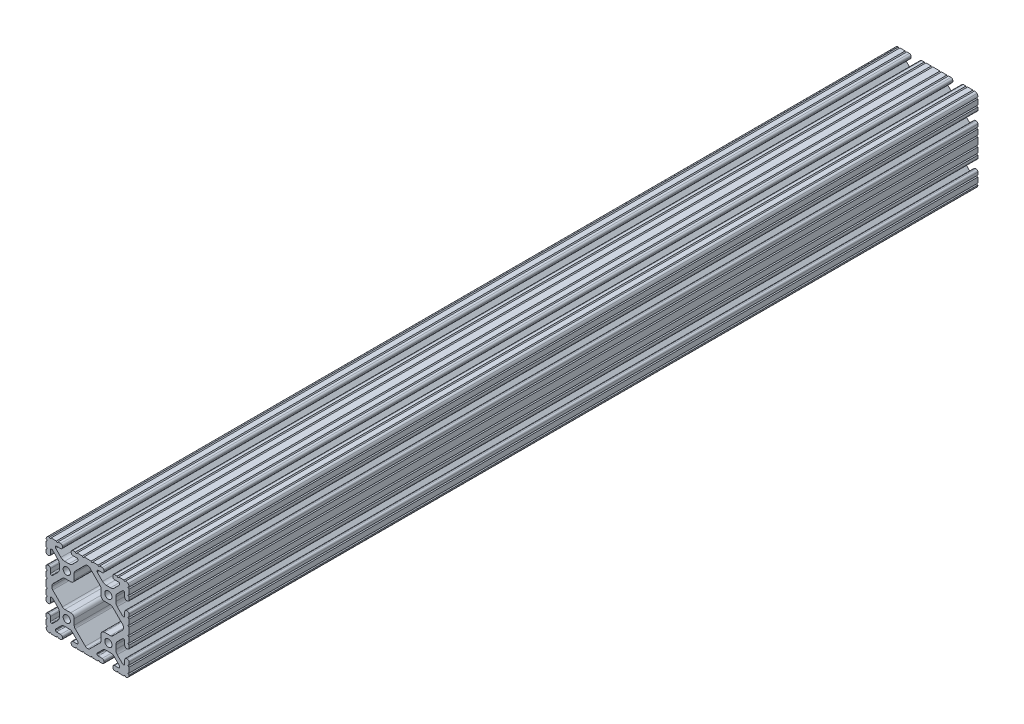
from build123d import *

# Parameters (mm, degrees)
BOSS_EXTRUDE1_DEPTH      = 388.8
BOSS_EXTRUDE1_DEPTH_BACK = 388.8
SKETCH3_R                = 3.3274


with BuildPart() as part:
    # Sketch3 → Boss-Extrude1 (new, two sides: drawn at the far end of the back side and taken through both)
    with BuildSketch(Plane.XY.offset(-BOSS_EXTRUDE1_DEPTH_BACK)):
        with BuildLine():
            Line((34.036, 28.448), (34.036, 24.630196049))
            ThreePointArc((34.036, 24.630196049), (34.497248241, 23.51664429), (35.6108, 23.055396049))
            Line((35.6108, 23.055396049), (36.525200183, 23.055396049))
            ThreePointArc((36.525200183, 23.055396049), (37.638751813, 23.516644236), (38.1, 24.630195866))
            Line((38.1, 24.630195866), (38.1, 27.023826138))
            ThreePointArc((38.1, 27.023826138), (37.117780706, 27.7845421), (38.1, 28.545258062))
            Line((38.1, 28.545258062), (38.1, 33.373016026))
            ThreePointArc((38.1, 33.373016026), (37.141472621, 34.109236774), (38.1, 34.845457521))
            ThreePointArc((38.1, 34.845457521), (37.837757813, 36.120195002), (37.086123144, 37.182631793))
            ThreePointArc((37.086123144, 37.182631793), (36.106286572, 37.843374398), (34.952681874, 38.1))
            ThreePointArc((34.952681874, 38.1), (34.190730434, 37.320215335), (33.428778994, 38.1))
            Line((33.428778994, 38.1), (28.601105935, 38.1))
            ThreePointArc((28.601105935, 38.1), (27.839158581, 37.32021942), (27.077211227, 38.1))
            Line((27.077211227, 38.1), (24.6888, 38.1))
            ThreePointArc((24.6888, 38.1), (23.575248241, 37.638751759), (23.114, 36.5252))
            Line((23.114, 36.5252), (23.114, 35.6108))
            ThreePointArc((23.114, 35.6108), (23.575248241, 34.497248241), (24.6888, 34.036))
            Line((24.6888, 34.036), (28.448, 34.036))
            ThreePointArc((28.448, 34.036), (29.076617928, 33.775617928), (29.337, 33.147))
            Line((29.337, 33.147), (29.337, 32.720693454))
            ThreePointArc((29.337, 32.720693454), (29.326675076, 32.273872751), (29.100231244, 31.888543625))
            Line((29.100231244, 31.888543625), (24.409287499, 27.197588341))
            ThreePointArc((24.409287499, 27.197588341), (22.868340045, 26.167958114), (21.050667579, 25.8064))
            Line((21.050667579, 25.8064), (17.049332421, 25.8064))
            ThreePointArc((17.049332421, 25.8064), (15.231659955, 26.167958114), (13.690712501, 27.197588341))
            Line((13.690712501, 27.197588341), (9.023381298, 31.864931024))
            ThreePointArc((9.023381298, 31.864931024), (8.830670886, 32.153343113), (8.763, 32.493548179))
            Line((8.763, 32.493548179), (8.763, 33.147))
            ThreePointArc((8.763, 33.147), (9.023382072, 33.775617928), (9.652, 34.036))
            Line((9.652, 34.036), (13.4112, 34.036))
            ThreePointArc((13.4112, 34.036), (14.524751759, 34.497248241), (14.986, 35.6108))
            Line((14.986, 35.6108), (14.986, 36.5252))
            ThreePointArc((14.986, 36.5252), (14.524751759, 37.638751759), (13.4112, 38.1))
            Line((13.4112, 38.1), (11.128867074, 38.1))
            ThreePointArc((11.128867074, 38.1), (10.367071033, 37.320370693), (9.605274992, 38.1))
            Line((9.605274992, 38.1), (4.777313069, 38.1))
            ThreePointArc((4.777313069, 38.1), (4.015517029, 37.320370693), (3.253720988, 38.1))
            Line((3.253720988, 38.1), (-3.253720988, 38.1))
            ThreePointArc((-3.253720988, 38.1), (-4.015517029, 37.320370693), (-4.777313069, 38.1))
            Line((-4.777313069, 38.1), (-9.605274992, 38.1))
            ThreePointArc((-9.605274992, 38.1), (-10.367071033, 37.320370693), (-11.128867074, 38.1))
            Line((-11.128867074, 38.1), (-13.4112, 38.1))
            ThreePointArc((-13.4112, 38.1), (-14.524751759, 37.638751759), (-14.986, 36.5252))
            Line((-14.986, 36.5252), (-14.986, 35.6108))
            ThreePointArc((-14.986, 35.6108), (-14.524751759, 34.497248241), (-13.4112, 34.036))
            Line((-13.4112, 34.036), (-9.652, 34.036))
            ThreePointArc((-9.652, 34.036), (-9.023382072, 33.775617928), (-8.763, 33.147))
            Line((-8.763, 33.147), (-8.763, 32.493548179))
            ThreePointArc((-8.763, 32.493548179), (-8.830670886, 32.153343113), (-9.023381298, 31.864931024))
            Line((-9.023381298, 31.864931024), (-13.690712501, 27.197588341))
            ThreePointArc((-13.690712501, 27.197588341), (-15.231659955, 26.167958114), (-17.049332421, 25.8064))
            Line((-17.049332421, 25.8064), (-21.050667579, 25.8064))
            ThreePointArc((-21.050667579, 25.8064), (-22.868340045, 26.167958114), (-24.409287499, 27.197588341))
            Line((-24.409287499, 27.197588341), (-29.100231244, 31.888543625))
            ThreePointArc((-29.100231244, 31.888543625), (-29.326675076, 32.273872751), (-29.337, 32.720693454))
            Line((-29.337, 32.720693454), (-29.337, 33.147))
            ThreePointArc((-29.337, 33.147), (-29.076617928, 33.775617928), (-28.448, 34.036))
            Line((-28.448, 34.036), (-24.6888, 34.036))
            ThreePointArc((-24.6888, 34.036), (-23.575248241, 34.497248241), (-23.114, 35.6108))
            Line((-23.114, 35.6108), (-23.114, 36.5252))
            ThreePointArc((-23.114, 36.5252), (-23.575248241, 37.638751759), (-24.6888, 38.1))
            Line((-24.6888, 38.1), (-27.077211227, 38.1))
            ThreePointArc((-27.077211227, 38.1), (-27.839158581, 37.32021942), (-28.601105935, 38.1))
            Line((-28.601105935, 38.1), (-33.428778994, 38.1))
            ThreePointArc((-33.428778994, 38.1), (-34.190730434, 37.320215335), (-34.952681874, 38.1))
            ThreePointArc((-34.952681874, 38.1), (-36.106286572, 37.843374398), (-37.086123144, 37.182631793))
            ThreePointArc((-37.086123144, 37.182631793), (-37.837757813, 36.120195002), (-38.1, 34.845457521))
            ThreePointArc((-38.1, 34.845457521), (-37.141472621, 34.109236774), (-38.1, 33.373016026))
            Line((-38.1, 33.373016026), (-38.1, 28.545258062))
            ThreePointArc((-38.1, 28.545258062), (-37.117780706, 27.7845421), (-38.1, 27.023826138))
            Line((-38.1, 27.023826138), (-38.1, 24.630195866))
            ThreePointArc((-38.1, 24.630195866), (-37.638751813, 23.516644236), (-36.525200183, 23.055396049))
            Line((-36.525200183, 23.055396049), (-35.6108, 23.055396049))
            ThreePointArc((-35.6108, 23.055396049), (-34.497248241, 23.51664429), (-34.036, 24.630196049))
            Line((-34.036, 24.630196049), (-34.036, 28.448))
            ThreePointArc((-34.036, 28.448), (-33.775617928, 29.076617928), (-33.147, 29.337))
            Line((-33.147, 29.337), (-32.664287242, 29.337))
            ThreePointArc((-32.664287242, 29.337), (-32.324081166, 29.269328695), (-32.03566854, 29.076617155))
            Line((-32.03566854, 29.076617155), (-27.19758008, 24.238516795))
            ThreePointArc((-27.19758008, 24.238516795), (-26.167955879, 22.697572205), (-25.8064, 20.879905136))
            Line((-25.8064, 20.879905136), (-25.8064, 17.220094864))
            ThreePointArc((-25.8064, 17.220094864), (-26.167955879, 15.402427795), (-27.19758008, 13.861483205))
            Line((-27.19758008, 13.861483205), (-31.948944541, 9.110107057))
            ThreePointArc((-31.948944541, 9.110107057), (-32.333417096, 8.853210196), (-32.786933649, 8.763))
            Line((-32.786933649, 8.763), (-33.060275787, 8.763))
            ThreePointArc((-33.060275787, 8.763), (-33.750216995, 9.048783005), (-34.036, 9.738724213))
            Line((-34.036, 9.738724213), (-34.036, 13.469803585))
            ThreePointArc((-34.036, 13.469803585), (-34.497248348, 14.583355603), (-35.610800366, 15.044603951))
            Line((-35.610800366, 15.044603951), (-36.5252, 15.044603951))
            ThreePointArc((-36.5252, 15.044603951), (-37.638751759, 14.58335571), (-38.1, 13.469803951))
            Line((-38.1, 13.469803951), (-38.1, 11.075039289))
            ThreePointArc((-38.1, 11.075039289), (-37.117000248, 10.313517272), (-38.1, 9.551995255))
            Line((-38.1, 9.551995255), (-38.1, 4.723759308))
            ThreePointArc((-38.1, 4.723759308), (-37.117000248, 3.962237292), (-38.1, 3.200715275))
            Line((-38.1, 3.200715275), (-38.1, -3.200715275))
            ThreePointArc((-38.1, -3.200715275), (-37.117000248, -3.962237292), (-38.1, -4.723759308))
            Line((-38.1, -4.723759308), (-38.1, -9.551995255))
            ThreePointArc((-38.1, -9.551995255), (-37.117000248, -10.313517272), (-38.1, -11.075039289))
            Line((-38.1, -11.075039289), (-38.1, -13.469803951))
            ThreePointArc((-38.1, -13.469803951), (-37.638751759, -14.58335571), (-36.5252, -15.044603951))
            Line((-36.5252, -15.044603951), (-35.610800366, -15.044603951))
            ThreePointArc((-35.610800366, -15.044603951), (-34.497248348, -14.583355603), (-34.036, -13.469803585))
            Line((-34.036, -13.469803585), (-34.036, -9.738724213))
            ThreePointArc((-34.036, -9.738724213), (-33.750216995, -9.048783005), (-33.060275787, -8.763))
            Line((-33.060275787, -8.763), (-32.786933649, -8.763))
            ThreePointArc((-32.786933649, -8.763), (-32.333417096, -8.853210196), (-31.948944541, -9.110107057))
            Line((-31.948944541, -9.110107057), (-27.19758008, -13.861483205))
            ThreePointArc((-27.19758008, -13.861483205), (-26.167955879, -15.402427795), (-25.8064, -17.220094864))
            Line((-25.8064, -17.220094864), (-25.8064, -20.879905136))
            ThreePointArc((-25.8064, -20.879905136), (-26.167955879, -22.697572205), (-27.19758008, -24.238516795))
            Line((-27.19758008, -24.238516795), (-32.03566854, -29.076617155))
            ThreePointArc((-32.03566854, -29.076617155), (-32.324081166, -29.269328695), (-32.664287242, -29.337))
            Line((-32.664287242, -29.337), (-33.147, -29.337))
            ThreePointArc((-33.147, -29.337), (-33.775617928, -29.076617928), (-34.036, -28.448))
            Line((-34.036, -28.448), (-34.036, -24.630196049))
            ThreePointArc((-34.036, -24.630196049), (-34.497248241, -23.51664429), (-35.6108, -23.055396049))
            Line((-35.6108, -23.055396049), (-36.525200183, -23.055396049))
            ThreePointArc((-36.525200183, -23.055396049), (-37.638751813, -23.516644236), (-38.1, -24.630195866))
            Line((-38.1, -24.630195866), (-38.1, -27.023826138))
            ThreePointArc((-38.1, -27.023826138), (-37.117780706, -27.7845421), (-38.1, -28.545258062))
            Line((-38.1, -28.545258062), (-38.1, -33.373016026))
            ThreePointArc((-38.1, -33.373016026), (-37.141472621, -34.109236774), (-38.1, -34.845457521))
            ThreePointArc((-38.1, -34.845457521), (-37.837757813, -36.120195002), (-37.086123144, -37.182631793))
            ThreePointArc((-37.086123144, -37.182631793), (-36.106286572, -37.843374398), (-34.952681874, -38.1))
            ThreePointArc((-34.952681874, -38.1), (-34.190730434, -37.320215335), (-33.428778994, -38.1))
            Line((-33.428778994, -38.1), (-28.601105935, -38.1))
            ThreePointArc((-28.601105935, -38.1), (-27.839158581, -37.32021942), (-27.077211227, -38.1))
            Line((-27.077211227, -38.1), (-24.6888, -38.1))
            ThreePointArc((-24.6888, -38.1), (-23.575248241, -37.638751759), (-23.114, -36.5252))
            Line((-23.114, -36.5252), (-23.114, -35.6108))
            ThreePointArc((-23.114, -35.6108), (-23.575248241, -34.497248241), (-24.6888, -34.036))
            Line((-24.6888, -34.036), (-28.448, -34.036))
            ThreePointArc((-28.448, -34.036), (-29.076617928, -33.775617928), (-29.337, -33.147))
            Line((-29.337, -33.147), (-29.337, -32.720693454))
            ThreePointArc((-29.337, -32.720693454), (-29.326675076, -32.273872751), (-29.100231244, -31.888543625))
            Line((-29.100231244, -31.888543625), (-24.409287499, -27.197588341))
            ThreePointArc((-24.409287499, -27.197588341), (-22.868340045, -26.167958114), (-21.050667579, -25.8064))
            Line((-21.050667579, -25.8064), (-17.049332421, -25.8064))
            ThreePointArc((-17.049332421, -25.8064), (-15.231659955, -26.167958114), (-13.690712501, -27.197588341))
            Line((-13.690712501, -27.197588341), (-9.023381298, -31.864931024))
            ThreePointArc((-9.023381298, -31.864931024), (-8.830670886, -32.153343113), (-8.763, -32.493548179))
            Line((-8.763, -32.493548179), (-8.763, -33.147))
            ThreePointArc((-8.763, -33.147), (-9.023382072, -33.775617928), (-9.652, -34.036))
            Line((-9.652, -34.036), (-13.4112, -34.036))
            ThreePointArc((-13.4112, -34.036), (-14.524751759, -34.497248241), (-14.986, -35.6108))
            Line((-14.986, -35.6108), (-14.986, -36.5252))
            ThreePointArc((-14.986, -36.5252), (-14.524751759, -37.638751759), (-13.4112, -38.1))
            Line((-13.4112, -38.1), (-11.128867074, -38.1))
            ThreePointArc((-11.128867074, -38.1), (-10.367071033, -37.320370693), (-9.605274992, -38.1))
            Line((-9.605274992, -38.1), (-4.777313069, -38.1))
            ThreePointArc((-4.777313069, -38.1), (-4.015517029, -37.320370693), (-3.253720988, -38.1))
            Line((-3.253720988, -38.1), (3.253720988, -38.1))
            ThreePointArc((3.253720988, -38.1), (4.015517029, -37.320370693), (4.777313069, -38.1))
            Line((4.777313069, -38.1), (9.605274992, -38.1))
            ThreePointArc((9.605274992, -38.1), (10.367071033, -37.320370693), (11.128867074, -38.1))
            Line((11.128867074, -38.1), (13.4112, -38.1))
            ThreePointArc((13.4112, -38.1), (14.524751759, -37.638751759), (14.986, -36.5252))
            Line((14.986, -36.5252), (14.986, -35.6108))
            ThreePointArc((14.986, -35.6108), (14.524751759, -34.497248241), (13.4112, -34.036))
            Line((13.4112, -34.036), (9.652, -34.036))
            ThreePointArc((9.652, -34.036), (9.023382072, -33.775617928), (8.763, -33.147))
            Line((8.763, -33.147), (8.763, -32.493548179))
            ThreePointArc((8.763, -32.493548179), (8.830670886, -32.153343113), (9.023381298, -31.864931024))
            Line((9.023381298, -31.864931024), (13.690712501, -27.197588341))
            ThreePointArc((13.690712501, -27.197588341), (15.231659955, -26.167958114), (17.049332421, -25.8064))
            Line((17.049332421, -25.8064), (21.050667579, -25.8064))
            ThreePointArc((21.050667579, -25.8064), (22.868340045, -26.167958114), (24.409287499, -27.197588341))
            Line((24.409287499, -27.197588341), (29.100231244, -31.888543625))
            ThreePointArc((29.100231244, -31.888543625), (29.326675076, -32.273872751), (29.337, -32.720693454))
            Line((29.337, -32.720693454), (29.337, -33.147))
            ThreePointArc((29.337, -33.147), (29.076617928, -33.775617928), (28.448, -34.036))
            Line((28.448, -34.036), (24.6888, -34.036))
            ThreePointArc((24.6888, -34.036), (23.575248241, -34.497248241), (23.114, -35.6108))
            Line((23.114, -35.6108), (23.114, -36.5252))
            ThreePointArc((23.114, -36.5252), (23.575248241, -37.638751759), (24.6888, -38.1))
            Line((24.6888, -38.1), (27.077211227, -38.1))
            ThreePointArc((27.077211227, -38.1), (27.839158581, -37.32021942), (28.601105935, -38.1))
            Line((28.601105935, -38.1), (33.428778994, -38.1))
            ThreePointArc((33.428778994, -38.1), (34.190730434, -37.320215335), (34.952681874, -38.1))
            ThreePointArc((34.952681874, -38.1), (36.106286572, -37.843374398), (37.086123144, -37.182631793))
            ThreePointArc((37.086123144, -37.182631793), (37.837757813, -36.120195002), (38.1, -34.845457521))
            ThreePointArc((38.1, -34.845457521), (37.141472621, -34.109236774), (38.1, -33.373016026))
            Line((38.1, -33.373016026), (38.1, -28.545258062))
            ThreePointArc((38.1, -28.545258062), (37.117780706, -27.7845421), (38.1, -27.023826138))
            Line((38.1, -27.023826138), (38.1, -24.630195866))
            ThreePointArc((38.1, -24.630195866), (37.638751813, -23.516644236), (36.525200183, -23.055396049))
            Line((36.525200183, -23.055396049), (35.6108, -23.055396049))
            ThreePointArc((35.6108, -23.055396049), (34.497248241, -23.51664429), (34.036, -24.630196049))
            Line((34.036, -24.630196049), (34.036, -28.448))
            ThreePointArc((34.036, -28.448), (33.775617928, -29.076617928), (33.147, -29.337))
            Line((33.147, -29.337), (32.664287242, -29.337))
            ThreePointArc((32.664287242, -29.337), (32.324081166, -29.269328695), (32.03566854, -29.076617155))
            Line((32.03566854, -29.076617155), (27.19758008, -24.238516795))
            ThreePointArc((27.19758008, -24.238516795), (26.167955879, -22.697572205), (25.8064, -20.879905136))
            Line((25.8064, -20.879905136), (25.8064, -17.220094864))
            ThreePointArc((25.8064, -17.220094864), (26.167955879, -15.402427795), (27.19758008, -13.861483205))
            Line((27.19758008, -13.861483205), (31.948944541, -9.110107057))
            ThreePointArc((31.948944541, -9.110107057), (32.333417096, -8.853210196), (32.786933649, -8.763))
            Line((32.786933649, -8.763), (33.060275787, -8.763))
            ThreePointArc((33.060275787, -8.763), (33.750216995, -9.048783005), (34.036, -9.738724213))
            Line((34.036, -9.738724213), (34.036, -13.469803585))
            ThreePointArc((34.036, -13.469803585), (34.497248348, -14.583355603), (35.610800366, -15.044603951))
            Line((35.610800366, -15.044603951), (36.5252, -15.044603951))
            ThreePointArc((36.5252, -15.044603951), (37.638751759, -14.58335571), (38.1, -13.469803951))
            Line((38.1, -13.469803951), (38.1, -11.075039289))
            ThreePointArc((38.1, -11.075039289), (37.117000248, -10.313517272), (38.1, -9.551995255))
            Line((38.1, -9.551995255), (38.1, -4.723759308))
            ThreePointArc((38.1, -4.723759308), (37.117000248, -3.962237292), (38.1, -3.200715275))
            Line((38.1, -3.200715275), (38.1, 3.200715275))
            ThreePointArc((38.1, 3.200715275), (37.117000248, 3.962237292), (38.1, 4.723759308))
            Line((38.1, 4.723759308), (38.1, 9.551995255))
            ThreePointArc((38.1, 9.551995255), (37.117000248, 10.313517272), (38.1, 11.075039289))
            Line((38.1, 11.075039289), (38.1, 13.469803951))
            ThreePointArc((38.1, 13.469803951), (37.638751759, 14.58335571), (36.5252, 15.044603951))
            Line((36.5252, 15.044603951), (35.610800366, 15.044603951))
            ThreePointArc((35.610800366, 15.044603951), (34.497248348, 14.583355603), (34.036, 13.469803585))
            Line((34.036, 13.469803585), (34.036, 9.738724213))
            ThreePointArc((34.036, 9.738724213), (33.750216995, 9.048783005), (33.060275787, 8.763))
            Line((33.060275787, 8.763), (32.786933649, 8.763))
            ThreePointArc((32.786933649, 8.763), (32.333417096, 8.853210196), (31.948944541, 9.110107057))
            Line((31.948944541, 9.110107057), (27.19758008, 13.861483205))
            ThreePointArc((27.19758008, 13.861483205), (26.167955879, 15.402427795), (25.8064, 17.220094864))
            Line((25.8064, 17.220094864), (25.8064, 20.879905136))
            ThreePointArc((25.8064, 20.879905136), (26.167955879, 22.697572205), (27.19758008, 24.238516795))
            Line((27.19758008, 24.238516795), (32.03566854, 29.076617155))
            ThreePointArc((32.03566854, 29.076617155), (32.324081166, 29.269328695), (32.664287242, 29.337))
            Line((32.664287242, 29.337), (33.147, 29.337))
            ThreePointArc((33.147, 29.337), (33.775617928, 29.076617928), (34.036, 28.448))
        make_face()
        with Locations((19.05, 19.05)):
            Circle(SKETCH3_R, mode=Mode.SUBTRACT)
        with Locations((-19.05, 19.05)):
            Circle(SKETCH3_R, mode=Mode.SUBTRACT)
        with Locations((19.05, -19.05)):
            Circle(SKETCH3_R, mode=Mode.SUBTRACT)
        with Locations((-19.05, -19.05)):
            Circle(SKETCH3_R, mode=Mode.SUBTRACT)
        with BuildLine():
            Line((-11.363666791, -22.843321003), (-2.051515952, -32.155494748))
            ThreePointArc((-2.051515952, -32.155494748), (-1.11031328, -32.786013752), (0, -33.011005091))
            ThreePointArc((0, -33.011005091), (1.11031328, -32.786013752), (2.051515952, -32.155494748))
            Line((2.051515952, -32.155494748), (11.363666791, -22.843321003))
            ThreePointArc((11.363666791, -22.843321003), (12.051918263, -21.813277828), (12.2936, -20.598259734))
            Line((12.2936, -20.598259734), (12.2936, -15.4686))
            ThreePointArc((12.2936, -15.4686), (13.22353597, -13.22353597), (15.4686, -12.2936))
            Line((15.4686, -12.2936), (20.769026744, -12.2936))
            ThreePointArc((20.769026744, -12.2936), (21.984048446, -12.051916769), (23.014093535, -11.363661269))
            Line((23.014093535, -11.363661269), (31.902125566, -2.475607377))
            ThreePointArc((31.902125566, -2.475607377), (32.607298578, -1.335259481), (32.728725173, 0))
            ThreePointArc((32.728725173, 0), (32.607298578, 1.335259481), (31.902125566, 2.475607377))
            Line((31.902125566, 2.475607377), (23.014093535, 11.363661269))
            ThreePointArc((23.014093535, 11.363661269), (21.984048446, 12.051916769), (20.769026744, 12.2936))
            Line((20.769026744, 12.2936), (15.4686, 12.2936))
            ThreePointArc((15.4686, 12.2936), (13.22353597, 13.22353597), (12.2936, 15.4686))
            Line((12.2936, 15.4686), (12.2936, 20.598259734))
            ThreePointArc((12.2936, 20.598259734), (12.051918263, 21.813277828), (11.363666791, 22.843321003))
            Line((11.363666791, 22.843321003), (2.051515952, 32.155494748))
            ThreePointArc((2.051515952, 32.155494748), (1.11031328, 32.786013752), (0, 33.011005091))
            ThreePointArc((0, 33.011005091), (-1.11031328, 32.786013752), (-2.051515952, 32.155494748))
            Line((-2.051515952, 32.155494748), (-11.363666791, 22.843321003))
            ThreePointArc((-11.363666791, 22.843321003), (-12.051918263, 21.813277828), (-12.2936, 20.598259734))
            Line((-12.2936, 20.598259734), (-12.2936, 15.4686))
            ThreePointArc((-12.2936, 15.4686), (-13.22353597, 13.22353597), (-15.4686, 12.2936))
            Line((-15.4686, 12.2936), (-20.769026744, 12.2936))
            ThreePointArc((-20.769026744, 12.2936), (-21.984048446, 12.051916769), (-23.014093535, 11.363661269))
            Line((-23.014093535, 11.363661269), (-31.902125566, 2.475607377))
            ThreePointArc((-31.902125566, 2.475607377), (-32.607298578, 1.335259481), (-32.728725173, 0))
            ThreePointArc((-32.728725173, 0), (-32.607298578, -1.335259481), (-31.902125566, -2.475607377))
            Line((-31.902125566, -2.475607377), (-23.014093535, -11.363661269))
            ThreePointArc((-23.014093535, -11.363661269), (-21.984048446, -12.051916769), (-20.769026744, -12.2936))
            Line((-20.769026744, -12.2936), (-15.4686, -12.2936))
            ThreePointArc((-15.4686, -12.2936), (-13.22353597, -13.22353597), (-12.2936, -15.4686))
            Line((-12.2936, -15.4686), (-12.2936, -20.598259734))
            ThreePointArc((-12.2936, -20.598259734), (-12.051918263, -21.813277828), (-11.363666791, -22.843321003))
        make_face(mode=Mode.SUBTRACT)
    extrude(amount=BOSS_EXTRUDE1_DEPTH + BOSS_EXTRUDE1_DEPTH_BACK)


solid = part.part
